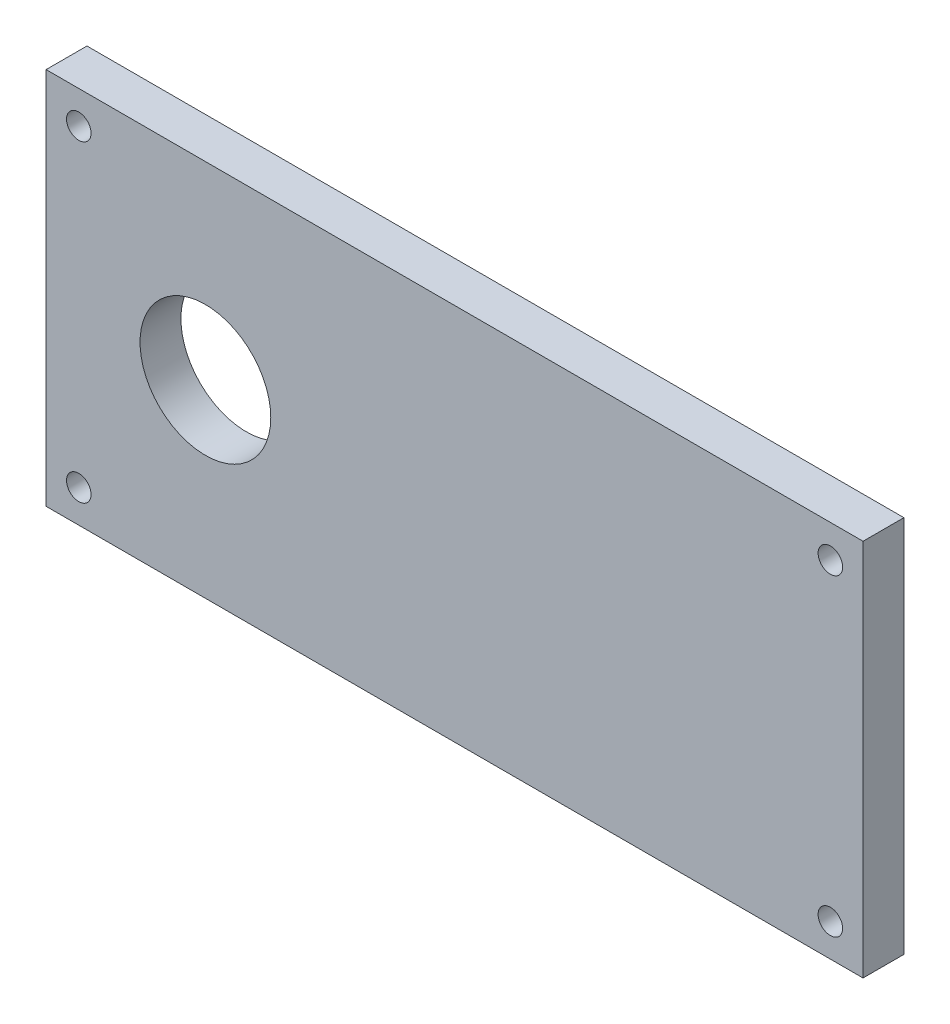
from build123d import *

# Parameters (mm, degrees)
SKETCH1_W           = 100
SKETCH1_H           = 46.3
SKETCH1_R           = 1.5
SKETCH1_R_2         = 8
BOSS_EXTRUDE1_DEPTH = 5


with BuildPart() as part:
    # Sketch1 → Boss-Extrude1 (new body)
    with BuildSketch(Plane.XY):
        Rectangle(SKETCH1_W, SKETCH1_H)
        with Locations(Location((46, 19.15, 0), (0, 0, 180))):
            Circle(SKETCH1_R, mode=Mode.SUBTRACT)
        with Locations((-46, 19.15)):
            Circle(SKETCH1_R, mode=Mode.SUBTRACT)
        with Locations((46, -19.15)):
            Circle(SKETCH1_R, mode=Mode.SUBTRACT)
        with Locations(Location((-46, -19.15, 0), (0, 0, 180))):
            Circle(SKETCH1_R, mode=Mode.SUBTRACT)
        with Locations((-30.5, 0)):
            Circle(SKETCH1_R_2, mode=Mode.SUBTRACT)
    extrude(amount=BOSS_EXTRUDE1_DEPTH)


solid = part.part
